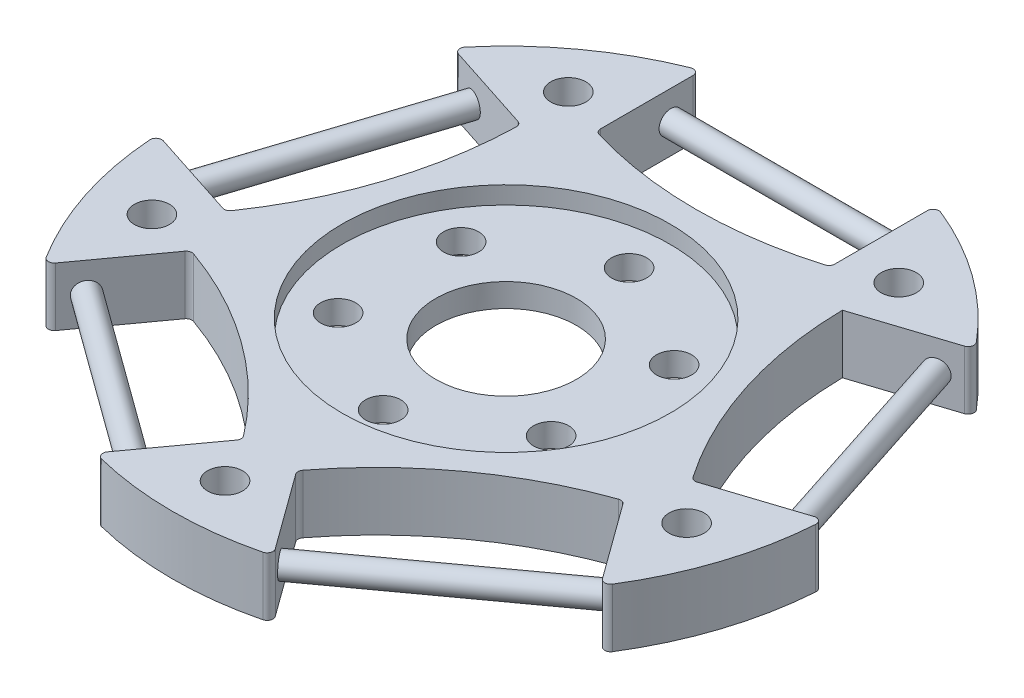
from build123d import *

# Parameters (mm, degrees)
SKETCH1_R           = 28.5
BOSS_EXTRUDE1_DEPTH = 5
CUT_EXTRUDE1_DEPTH  = 41.614036982
CIRPATTERN1_COUNT   = 5
SKETCH3_R           = 14
CUT_EXTRUDE2_DEPTH  = 1.5
SKETCH4_R           = 1.5
SKETCH4_R_2         = 6
CUT_EXTRUDE3_DEPTH  = 41.437031639
SKETCH5_R           = 1.5
CUT_EXTRUDE4_DEPTH  = 41.594378032
CIRPATTERN2_COUNT   = 5
FILLET1_R           = 0.5
BOSS_EXTRUDE2_REACH = 52.405
SKETCH7_R           = 1
CIRPATTERN3_COUNT   = 5


with BuildPart() as part:
    # Sketch1 → Boss-Extrude1 (new body)
    with BuildSketch(Plane(origin=(0, 0, 0), x_dir=(1, 0, 0), z_dir=(0, 1, 0))):
        with Locations(Location((0, 0, 0), (0, 0, 270))):
            Circle(SKETCH1_R)
    extrude(amount=BOSS_EXTRUDE1_DEPTH)

    # Sketch2 → Cut-Extrude1 (cut, through all)
    with BuildSketch(Plane(origin=(0, 5, 0), x_dir=(1, 0, 0), z_dir=(0, 1, 0))):
        with BuildLine():
            Line((10, 26.68801229), (10, 17.68801229))
            ThreePointArc((10, 17.68801229), (0, 16.180315356), (-10, 17.68801229))
            Line((-10, 17.68801229), (-10, 26.68801229))
            ThreePointArc((-10, 26.68801229), (0, 28.5), (10, 26.68801229))
        make_face()
    cut_extrude1 = extrude(amount=-CUT_EXTRUDE1_DEPTH, mode=Mode.SUBTRACT)

    # CirPattern1: Cut-Extrude1 ×5 about axis
    cirpattern1_axis = Axis((0, 0, 0), (0, 1, 0))
    for i in range(1, CIRPATTERN1_COUNT):
        add(cut_extrude1.rotate(cirpattern1_axis, i * 360 / CIRPATTERN1_COUNT), mode=Mode.SUBTRACT)

    # Sketch3 → Cut-Extrude2 (cut)
    with BuildSketch(Plane(origin=(0, 5, 0), x_dir=(1, 0, 0), z_dir=(0, 1, 0))):
        with Locations(Location((0, 0, 0), (0, 0, 270))):
            Circle(SKETCH3_R)
    cut_extrude2 = extrude(amount=-CUT_EXTRUDE2_DEPTH, mode=Mode.SUBTRACT)

    # Mirror1: Cut-Extrude2 across plane
    add(cut_extrude2.mirror(Plane.ZX.offset(2.5)), mode=Mode.SUBTRACT)

    # Sketch4 → Cut-Extrude3 (cut, through all)
    with BuildSketch(Plane(origin=(0, 3.5, 0), x_dir=(1, 0, 0), z_dir=(0, 1, 0))):
        with Locations(Location((0, 10.5, 0), (0, 0, 270))):
            Circle(SKETCH4_R)
        with Locations(Location((9.09326674, 5.25, 0), (0, 0, 270))):
            Circle(SKETCH4_R)
        with Locations(Location((9.09326674, -5.25, 0), (0, 0, 270))):
            Circle(SKETCH4_R)
        with Locations(Location((0, -10.5, 0), (0, 0, 270))):
            Circle(SKETCH4_R)
        with Locations(Location((-9.09326674, -5.25, 0), (0, 0, 270))):
            Circle(SKETCH4_R)
        with Locations(Location((-9.09326674, 5.25, 0), (0, 0, 270))):
            Circle(SKETCH4_R)
        with Locations(Location((0, 0, 0), (0, 0, 270))):
            Circle(SKETCH4_R_2)
    extrude(amount=-CUT_EXTRUDE3_DEPTH, mode=Mode.SUBTRACT)

    # Sketch5 → Cut-Extrude4 (cut, through all)
    with BuildSketch(Plane(origin=(0, 5, 0), x_dir=(1, 0, 0), z_dir=(0, 1, 0))):
        with Locations(Location((0, -24, 0), (0, 0, 270))):
            Circle(SKETCH5_R)
    cut_extrude4 = extrude(amount=-CUT_EXTRUDE4_DEPTH, mode=Mode.SUBTRACT)

    # CirPattern2: Cut-Extrude4 ×5 about axis
    cirpattern2_axis = Axis((0, 0, 0), (0, 1, 0))
    for i in range(1, CIRPATTERN2_COUNT):
        add(cut_extrude4.rotate(cirpattern2_axis, i * 360 / CIRPATTERN2_COUNT), mode=Mode.SUBTRACT)

    # Fillet1
    fillet1_edges = [part.edges().sort_by_distance(p)[0] for p in [
        (-10, 2.5, -26.68801229),
        (10, 2.5, -26.68801229),
        (10, 2.5, -17.68801229),
        (-10, 2.5, -17.68801229),
        (22.291638052, 2.5, -17.757614507),
        (28.471977939, 2.5, 1.263515819),
        (19.912469293, 2.5, 4.044668769),
        (23.776989981, 2.5, 15.713202966),
        (7.596650093, 2.5, 27.468908012),
        (2.306582823, 2.5, 20.187755062),
        (18.48692271, 2.5, 8.432050017),
        (-7.596650093, 2.5, 27.468908012),
        (-23.776989981, 2.5, 15.713202966),
        (-18.48692271, 2.5, 8.432050017),
        (-2.306582823, 2.5, 20.187755062),
        (-28.471977939, 2.5, 1.263515819),
        (-22.291638052, 2.5, -17.757614507),
        (-13.732129405, 2.5, -14.976461557),
        (-19.912469293, 2.5, 4.044668769),
    ]]
    fillet(fillet1_edges, radius=FILLET1_R)

    # Sketch7 → Boss-Extrude2 (add, up to next)
    with BuildSketch(Plane(origin=(-8.090169944, 0, -5.877852523), x_dir=(0.5877852522924683, 0, -0.809016994374951), z_dir=(0.809016994374951, 0, 0.5877852522924683)), mode=Mode.PRIVATE) as boss_extrude2_sk1:
        with Locations(Location((-24.059120617, 2.5, 0), (0, 0, 180))):
            Circle(SKETCH7_R)
    boss_extrude2_tool1 = extrude(boss_extrude2_sk1.sketch, amount=BOSS_EXTRUDE2_REACH, mode=Mode.PRIVATE) - part.part
    boss_extrude2 = boss_extrude2_tool1.solids().sort_by_distance((-22.231766, 2.5, 13.586385))[0]
    add(boss_extrude2)

    # CirPattern3: Boss-Extrude2 ×5 about axis
    cirpattern3_axis = Axis((0, 3.5, 0), (0, 1, 0))
    for i in range(1, CIRPATTERN3_COUNT):
        add(boss_extrude2.rotate(cirpattern3_axis, i * 360 / CIRPATTERN3_COUNT))


solid = part.part
